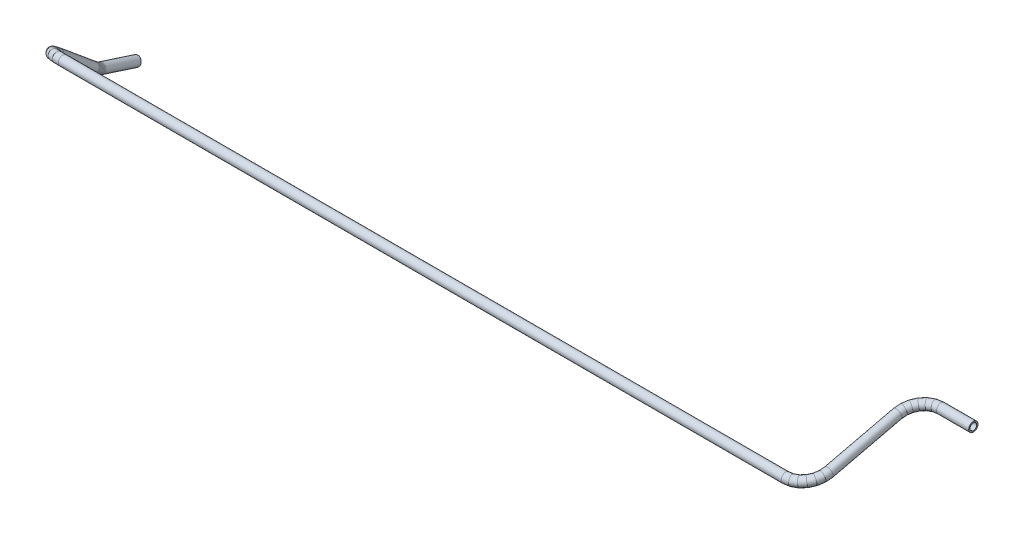
from build123d import *

# Parameters (mm, degrees)
PROFILE_R   = 3.175
PROFILE_R_2 = 2.286


with BuildPart() as part:
    # Tube: sweep along a curve in space
    with BuildLine() as tube_path:
        Line((-2218.987960479, 62, 0), (-2241.187960479, 62, 0))
        Line((-2241.187960479, 62, 0), (-2245.070246155, 61.882513484, 0.497426391))
        Line((-2245.070246155, 61.882513484, 0.497426391), (-2248.687960479, 61.538060449, 1.955806777))
        Line((-2248.687960479, 61.538060449, 1.955806777), (-2251.794562197, 60.990114799, 4.275754945))
        Line((-2251.794562197, 60.990114799, 4.275754945), (-2254.178341536, 60.276018126, 7.299170261))
        Line((-2254.178341536, 60.276018126, 7.299170261), (-2255.676847873, 59.444434936, 10.820011968))
        Line((-2255.676847873, 59.444434936, 10.820011968), (-2256.187960479, 58.552036251, 14.598340522))
        Line((-2256.187960479, 58.552036251, 14.598340522), (-2256.187960479, 47.447963749, 61.611895011))
        Line((-2256.187960479, 47.447963749, 61.611895011), (-2256.699073085, 46.555565064, 65.390223565))
        Line((-2256.699073085, 46.555565064, 65.390223565), (-2258.197579422, 45.723981874, 68.911065272))
        Line((-2258.197579422, 45.723981874, 68.911065272), (-2260.581358761, 45.009885201, 71.934480588))
        Line((-2260.581358761, 45.009885201, 71.934480588), (-2263.687960479, 44.461939551, 74.254428756))
        Line((-2263.687960479, 44.461939551, 74.254428756), (-2267.305674802, 44.117486516, 75.712809142))
        Line((-2267.305674802, 44.117486516, 75.712809142), (-2271.187960479, 44, 76.210235533))
        Line((-2271.187960479, 44, 76.210235533), (-2765.092778381, 44, 76.210235533))
        Line((-2765.092778381, 44, 76.210235533), (-2768.975064057, 43.673812846, 75.816740887))
        Line((-2768.975064057, 43.673812846, 75.816740887), (-2772.592778381, 42.717480499, 74.66307296))
        Line((-2772.592778381, 42.717480499, 74.66307296), (-2775.699380099, 41.196175429, 72.827852314))
        Line((-2775.699380099, 41.196175429, 72.827852314), (-2778.083159438, 39.213572062, 70.436146203))
        Line((-2778.083159438, 39.213572062, 70.436146203), (-2779.581665775, 36.90478154, 67.650945446))
        Line((-2779.581665775, 36.90478154, 67.650945446), (-2780.092778381, 34.427144123, 64.662056873))
        Line((-2780.092778381, 34.427144123, 64.662056873), (-2780.092778381, 14.191736335, 40.251148841))
        Line((-2780.092778381, 14.191736335, 40.251148841), (-2780.092778381, 13.611975374, 39.505131614))
        Line((-2780.092778381, 13.611975374, 39.505131614), (-2780.092778381, 13.080330772, 38.724094808))
        Line((-2780.092778381, 13.080330772, 38.724094808), (-2780.092778381, 12.598911775, 37.911137107))
        Line((-2780.092778381, 12.598911775, 37.911137107), (-2780.092778381, 12.169628364, 37.069483836))
        Line((-2780.092778381, 12.169628364, 37.069483836), (-2780.092778381, 11.794183676, 36.20247417))
        Line((-2780.092778381, 11.794183676, 36.20247417), (-2780.092778381, 11.47406725, 35.31354788))
        Line((-2780.092778381, 11.47406725, 35.31354788), (-2780.092778381, 3.615498834, 11.127361241))
    # Profile → Tube (sweep)
    with BuildSketch(Plane(origin=(-2218.987960479, 0, 0), x_dir=(0, 0, -1), z_dir=(1, 0, 0))):
        with Locations((0, 62)):
            Circle(PROFILE_R)
        with Locations((0, 62)):
            Circle(PROFILE_R_2, mode=Mode.SUBTRACT)
    sweep(path=tube_path.line, transition=Transition.RIGHT)


solid = part.part
